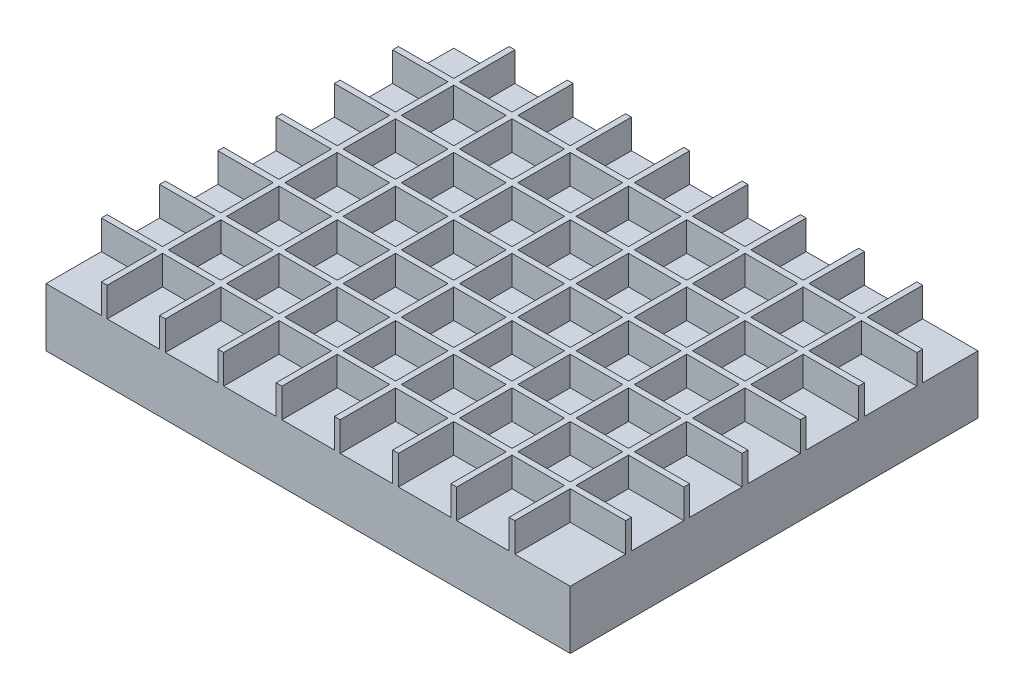
from build123d import *

# Parameters (mm, degrees)
SKETCH1_W           = 90
SKETCH1_H           = 70
BOSS_EXTRUDE1_DEPTH = 10
SHELL3_T            = -1
SKETCH2_W           = 1
SKETCH2_H           = 70
BOSS_EXTRUDE2_DEPTH = 5
LPATTERN1_COUNT     = 8
LPATTERN1_PITCH     = 10
SKETCH3_W           = 90
SKETCH3_H           = 1
BOSS_EXTRUDE3_DEPTH = 5
LPATTERN2_COUNT     = 6
LPATTERN2_PITCH     = 10


with BuildPart() as part:
    # Sketch1 → Boss-Extrude1 (new body)
    with BuildSketch(Plane(origin=(0, 0, 0), x_dir=(1, 0, 0), z_dir=(0, 1, 0))):
        Rectangle(SKETCH1_W, SKETCH1_H)
    extrude(amount=BOSS_EXTRUDE1_DEPTH)

    # Shell3
    shell3_openings = [part.faces().sort_by_distance(p)[0] for p in [
        (0, 0, 0),
    ]]
    offset(amount=SHELL3_T, openings=shell3_openings, kind=Kind.INTERSECTION)

    # Sketch2 → Boss-Extrude2 (add)
    with BuildSketch(Plane(origin=(0, 10, 0), x_dir=(1, 0, 0), z_dir=(0, 1, 0))):
        with Locations((-35, 0)):
            Rectangle(SKETCH2_W, SKETCH2_H)
    boss_extrude2 = extrude(amount=BOSS_EXTRUDE2_DEPTH)

    # LPattern1: Boss-Extrude2 ×8
    with Locations(*[(i * LPATTERN1_PITCH, 0, 0) for i in range(1, LPATTERN1_COUNT)]):
        add(boss_extrude2)

    # Sketch3 → Boss-Extrude3 (add)
    with BuildSketch(Plane(origin=(0, 10, 0), x_dir=(1, 0, 0), z_dir=(0, 1, 0))):
        with Locations((0, 25)):
            Rectangle(SKETCH3_W, SKETCH3_H)
    boss_extrude3 = extrude(amount=BOSS_EXTRUDE3_DEPTH)

    # LPattern2: Boss-Extrude3 ×6
    with Locations(*[(0, 0, i * LPATTERN2_PITCH) for i in range(1, LPATTERN2_COUNT)]):
        add(boss_extrude3)


solid = part.part
